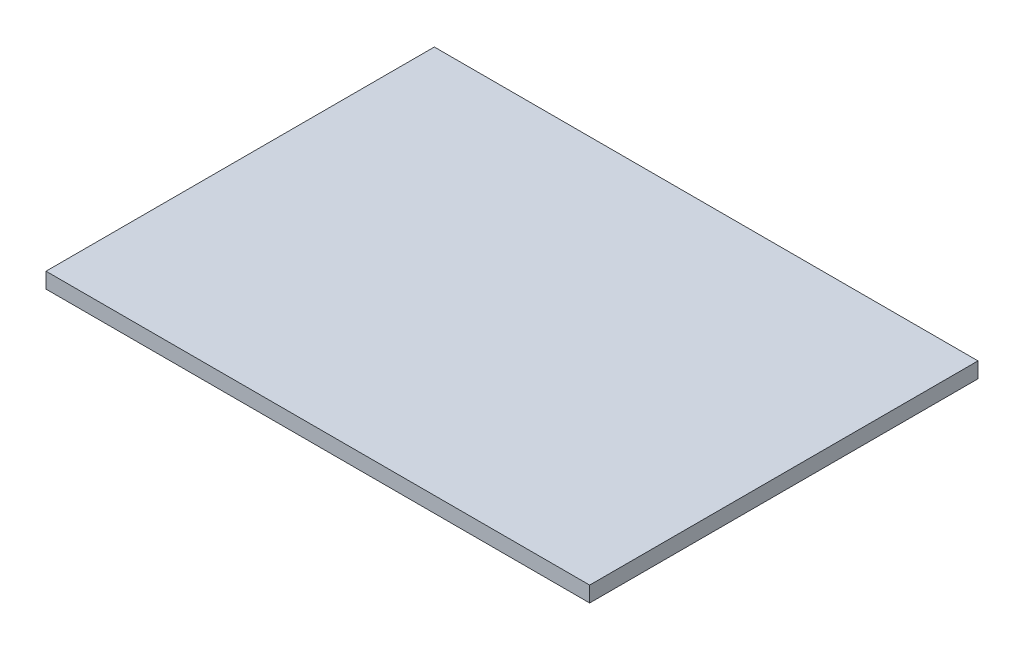
from build123d import *

# Parameters (mm, degrees)
SKETCH1_W           = 70
SKETCH1_H           = 50
BOSS_EXTRUDE1_DEPTH = 2


with BuildPart() as part:
    # Sketch1 → Boss-Extrude1 (new body)
    with BuildSketch(Plane(origin=(0, 0, 0), x_dir=(1, 0, 0), z_dir=(0, 1, 0))):
        with Locations((35, 25)):
            Rectangle(SKETCH1_W, SKETCH1_H)
    extrude(amount=BOSS_EXTRUDE1_DEPTH)


solid = part.part
